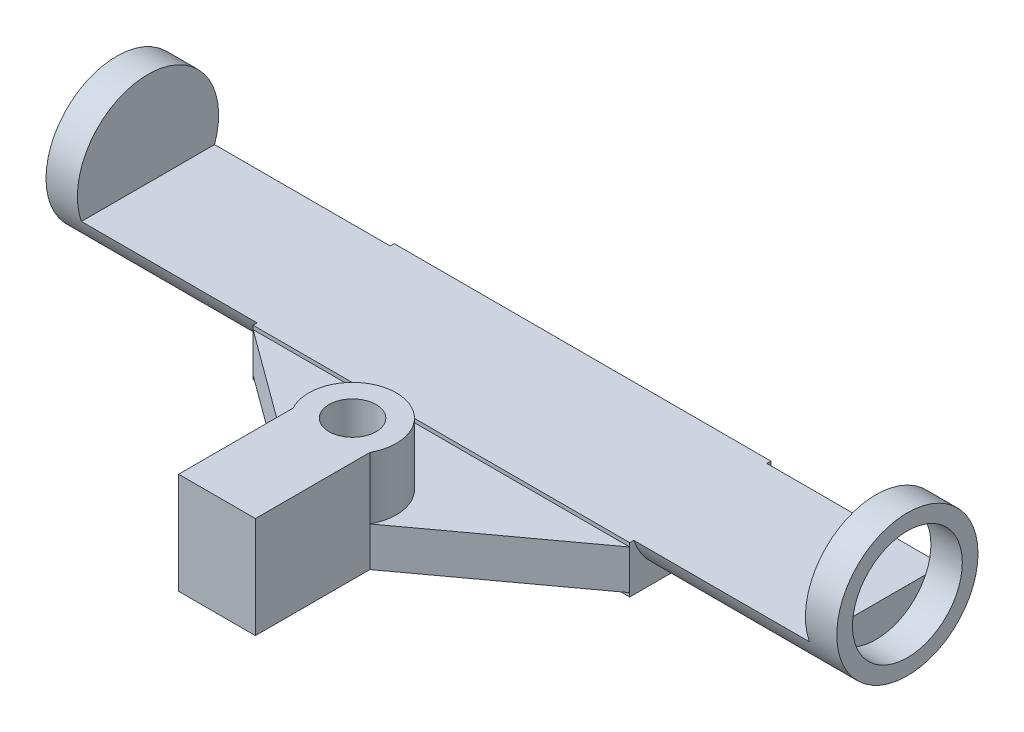
from build123d import *

# Parameters (mm, degrees)
SKETCH1_W           = 160
SKETCH1_H           = 28.575
BOSS_EXTRUDE1_DEPTH = 28.575
SKETCH3_W           = 147.3
SKETCH3_H           = 28.575
CUT_EXTRUDE3_DEPTH  = 19.05
SKETCH4_W           = 76.2
SKETCH4_H           = 8
BOSS_EXTRUDE2_DEPTH = 45.4
CUT_EXTRUDE8_DEPTH  = 124.871382326
SKETCH9_R           = 4.7625
BOSS_EXTRUDE4_DEPTH = 12.525
SKETCH10_R          = 4.7625
CUT_EXTRUDE10_DEPTH = 124.871382326
CUT_EXTRUDE11_START = -41.9
SKETCH2_OUTSIDE_W   = 111.689
SKETCH2_OUTSIDE_H   = 66.289
SKETCH2_OUTSIDE_R   = 14.2875
CUT_EXTRUDE11_DEPTH = 41.9
CUT_EXTRUDE13_START = -41.9
SKETCH13_OUTSIDE_W  = 111.689
SKETCH13_OUTSIDE_H  = 66.289
SKETCH13_OUTSIDE_R  = 14.2875
CUT_EXTRUDE13_DEPTH = 41.9
SKETCH14_R          = 11.1125
CUT_EXTRUDE14_DEPTH = 6.35


with BuildPart() as part:
    # Sketch1 → Boss-Extrude1 (new body)
    with BuildSketch(Plane(origin=(0, 0, 0), x_dir=(1, 0, 0), z_dir=(0, 1, 0))):
        with Locations((-20.782379652, -9.554800327)):
            Rectangle(SKETCH1_W, SKETCH1_H)
    extrude(amount=BOSS_EXTRUDE1_DEPTH)

    # Sketch3 → Cut-Extrude3 (cut)
    with BuildSketch(Plane(origin=(0, 28.575, 0), x_dir=(1, 0, 0), z_dir=(0, 1, 0))):
        with Locations((-20.782379652, -9.554800327)):
            Rectangle(SKETCH3_W, SKETCH3_H)
    extrude(amount=-CUT_EXTRUDE3_DEPTH, mode=Mode.SUBTRACT)

    # Sketch4 → Boss-Extrude2 (add)
    with BuildSketch(Plane.XY.offset(23.842300327)):
        with Locations((-20.782379652, 4.7625)):
            Rectangle(SKETCH4_W, SKETCH4_H)
    extrude(amount=BOSS_EXTRUDE2_DEPTH)

    # Sketch5 → Cut-Extrude8 (cut, through all)
    with BuildSketch(Plane(origin=(0, 8.7625, 0), x_dir=(1, 0, 0), z_dir=(0, 1, 0))):
        Polygon((-13.013921372, -46.075787503), (-13.013921372, -69.242300327), (17.317620348, -69.242300327), (17.317620348, -23.842300327), align=None)
        Polygon((-28.550837933, -69.242300327), (-28.550837933, -46.075787503), (-58.882379652, -23.842300327), (-58.882379652, -69.242300327), align=None)
    extrude(amount=-CUT_EXTRUDE8_DEPTH, mode=Mode.SUBTRACT)

    # Sketch9 → Boss-Extrude4 (add)
    with BuildSketch(Plane(origin=(0, 8.7625, 0), x_dir=(1, 0, 0), z_dir=(0, 1, 0))):
        with BuildLine():
            Line((-28.550837933, -46.075787503), (-28.550837933, -69.242300327))
            Line((-28.550837933, -69.242300327), (-13.013921372, -69.242300327))
            Line((-13.013921372, -69.242300327), (-13.013921372, -46.075787503))
            ThreePointArc((-13.013921372, -46.075787503), (-20.782379652, -32.954800327), (-28.550837933, -46.075787503))
        make_face()
        with Locations(Location((-20.782379652, -41.815004419, 0), (0, 0, 180))):
            Circle(SKETCH9_R, mode=Mode.SUBTRACT)
    extrude(amount=BOSS_EXTRUDE4_DEPTH)

    # Sketch10 → Cut-Extrude10 (cut, through all)
    with BuildSketch(Plane(origin=(0, 8.7625, 0), x_dir=(1, 0, 0), z_dir=(0, 1, 0))):
        with Locations(Location((-20.782379652, -41.815004419, 0), (0, 0, 180))):
            Circle(SKETCH10_R)
    extrude(amount=-CUT_EXTRUDE10_DEPTH, mode=Mode.SUBTRACT)

    # Sketch2 outside → Cut-Extrude11 (cut)
    with BuildSketch(Plane(origin=(59.217620348, 0, 0), x_dir=(0, 0, -1), z_dir=(1, 0, 0)).offset(CUT_EXTRUDE11_START)):
        with Locations((-32.2545, 14.2875)):
            Rectangle(SKETCH2_OUTSIDE_W, SKETCH2_OUTSIDE_H)
        with Locations((-9.554800327, 14.2875)):
            Circle(SKETCH2_OUTSIDE_R, mode=Mode.SUBTRACT)
    extrude(amount=CUT_EXTRUDE11_DEPTH, mode=Mode.SUBTRACT)

    # Sketch13 outside → Cut-Extrude13 (cut)
    with BuildSketch(Plane.ZY.offset(100.782379652).offset(CUT_EXTRUDE13_START)):
        with Locations((32.2545, 14.2875)):
            Rectangle(SKETCH13_OUTSIDE_W, SKETCH13_OUTSIDE_H)
        with Locations(Location((9.554800327, 14.2875, 0), (0, 0, 180))):
            Circle(SKETCH13_OUTSIDE_R, mode=Mode.SUBTRACT)
    extrude(amount=CUT_EXTRUDE13_DEPTH, mode=Mode.SUBTRACT)

    # Sketch14 → Cut-Extrude14 (cut)
    with BuildSketch(Plane(origin=(59.217620348, 0, 0), x_dir=(0, 0, -1), z_dir=(1, 0, 0))):
        with Locations((-9.554800327, 14.2875)):
            Circle(SKETCH14_R)
    extrude(amount=-CUT_EXTRUDE14_DEPTH, mode=Mode.SUBTRACT)


solid = part.part
